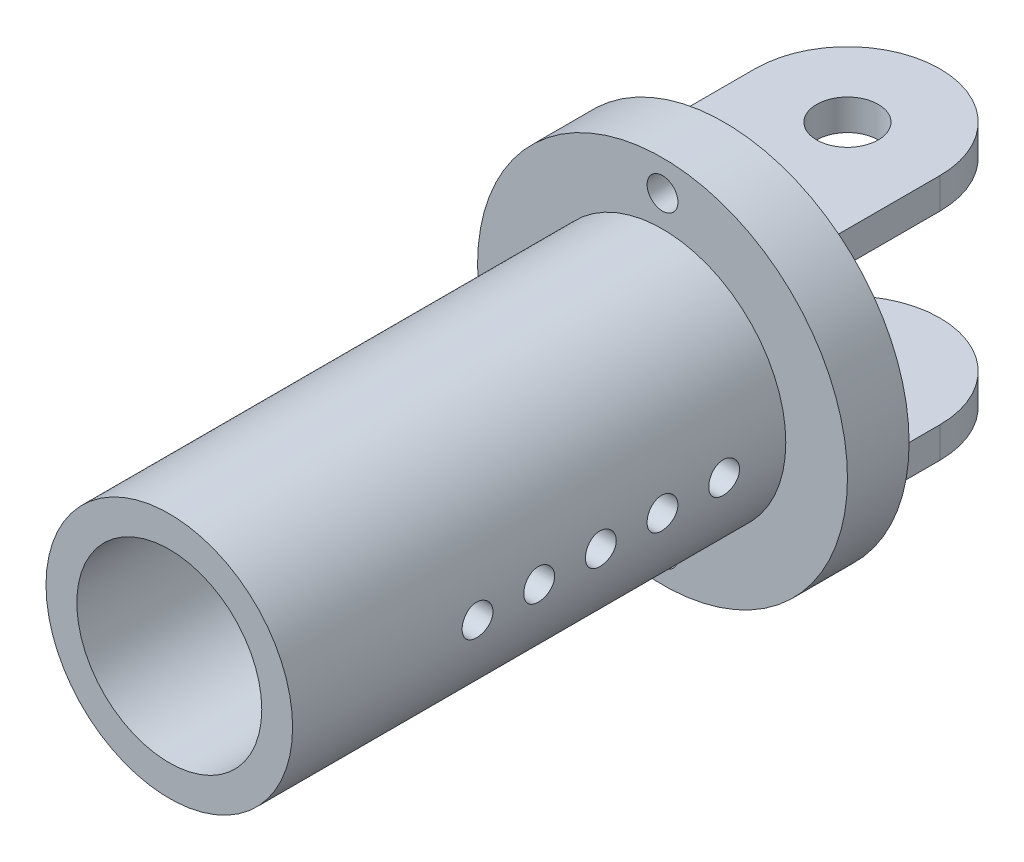
from build123d import *

# Parameters (mm, degrees)
SKETCH1_R               = 38.1
SKETCH1_R_2             = 19.05
SKETCH1_R_3             = 3.175
BOSS_EXTRUDE1_DEPTH     = 12.7
SKETCH1_3_R             = 25.4
SKETCH1_3_R_2           = 19.05
BOSS_EXTRUDE2_DEPTH     = 101.6
SKETCH2_R               = 6.35
BOSS_EXTRUDE3_DEPTH     = 6.35
CUT_EXTRUDE1_DEPTH      = 116.003391254
CUT_EXTRUDE1_DEPTH_BACK = 116.003391254
SKETCH3_R               = 3.175


with BuildPart() as part:
    # Sketch1 → Boss-Extrude1 (new body)
    with BuildSketch(Plane.XY):
        Circle(SKETCH1_R)
        Circle(SKETCH1_R_2, mode=Mode.SUBTRACT)
        with Locations((0, -31.75)):
            Circle(SKETCH1_R_3, mode=Mode.SUBTRACT)
        with Locations((0, 31.75)):
            Circle(SKETCH1_R_3, mode=Mode.SUBTRACT)
    extrude(amount=-BOSS_EXTRUDE1_DEPTH)

    # Sketch2 → Boss-Extrude3 (add)
    with BuildSketch(Plane(origin=(0, 25.4, 0), x_dir=(1, 0, 0), z_dir=(0, 1, 0))):
        with BuildLine():
            Line((19.05, 12.7), (19.05, 38.1))
            ThreePointArc((19.05, 38.1), (0, 57.15), (-19.05, 38.1))
            Line((-19.05, 38.1), (-19.05, 12.7))
            Line((-19.05, 12.7), (19.05, 12.7))
        make_face()
        with Locations((0, 38.1)):
            Circle(SKETCH2_R, mode=Mode.SUBTRACT)
    boss_extrude3 = extrude(amount=-BOSS_EXTRUDE3_DEPTH)

    # Mirror1: Boss-Extrude3 across plane
    add(boss_extrude3.mirror(Plane.ZX))


with BuildPart() as body_2:
    # Sketch1<3> → Boss-Extrude2 (new body)
    with BuildSketch(Plane.XY):
        Circle(SKETCH1_3_R)
        Circle(SKETCH1_3_R_2, mode=Mode.SUBTRACT)
    extrude(amount=BOSS_EXTRUDE2_DEPTH)

    # Sketch3 → Cut-Extrude1 (cut, two sides: drawn at the far end of the back side and taken through both)
    with BuildSketch(Plane(origin=(0, 0, 0), x_dir=(0, 0, -1), z_dir=(1, 0, 0)).offset(-CUT_EXTRUDE1_DEPTH_BACK)):
        with Locations((-63.5, 0)):
            Circle(SKETCH3_R)
        with Locations((-50.8, 0)):
            Circle(SKETCH3_R)
        with Locations((-38.1, 0)):
            Circle(SKETCH3_R)
        with Locations((-25.4, 0)):
            Circle(SKETCH3_R)
        with Locations((-12.7, 0)):
            Circle(SKETCH3_R)
    extrude(amount=CUT_EXTRUDE1_DEPTH + CUT_EXTRUDE1_DEPTH_BACK, mode=Mode.SUBTRACT)


solid = Compound([part.part, body_2.part])
